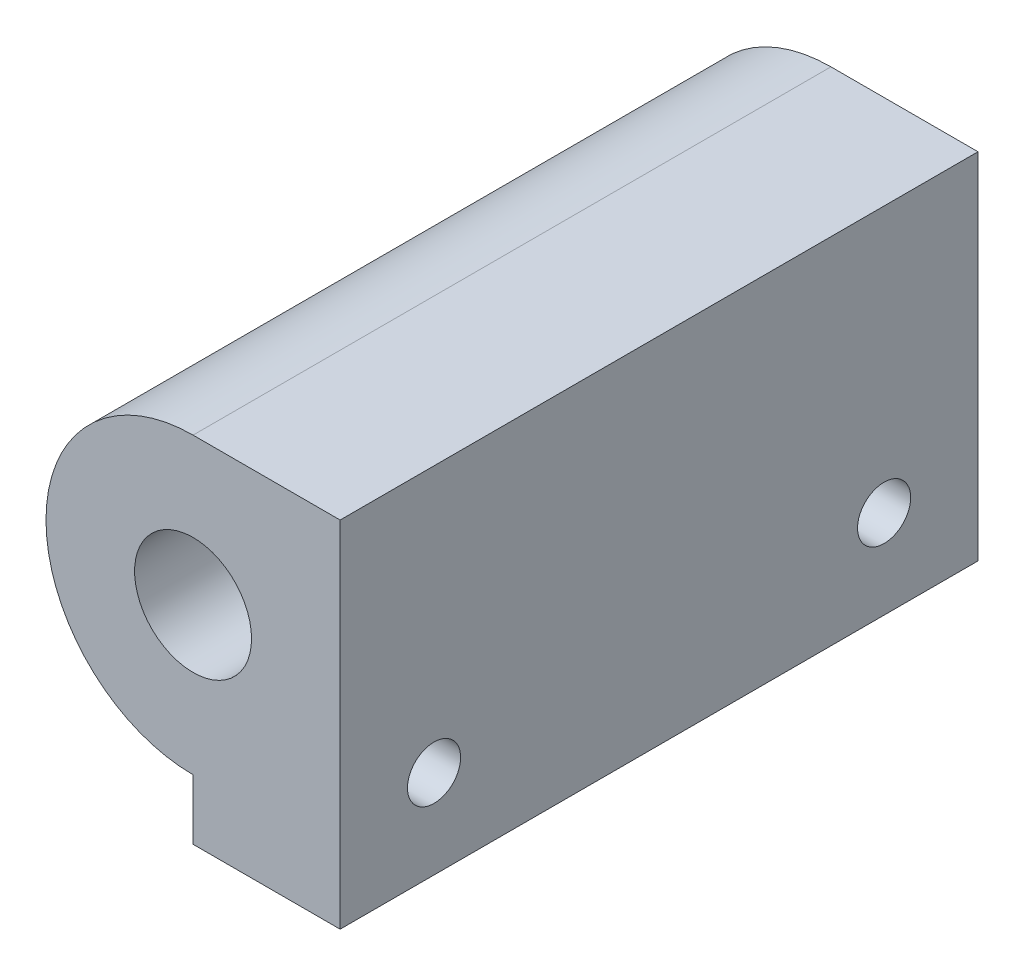
from build123d import *

# Parameters (mm, degrees)
ESQUISSE1_R             = 1.65
BOSS_EXTRU_1_DEPTH      = 9
ESQUISSE2_R             = 0.75
ENL_V_MAT_EXTRU_1_DEPTH = 14.568806138


with BuildPart() as part:
    # Esquisse1 → Boss.-Extru.1 (new, symmetric)
    with BuildSketch(Plane.XY):
        with BuildLine():
            Line((0, -4.15), (0, -5.85))
            Line((0, -5.85), (4.15, -5.85))
            Line((4.15, -5.85), (4.15, 4.15))
            Line((4.15, 4.15), (0, 4.15))
            ThreePointArc((0, 4.15), (-4.15, 0), (0, -4.15))
        make_face()
        Circle(ESQUISSE1_R, mode=Mode.SUBTRACT)
    extrude(amount=BOSS_EXTRU_1_DEPTH, both=True)

    # Esquisse2 → Enlèv. mat.-Extru.1 (cut, through all)
    with BuildSketch(Plane(origin=(4.15, 0, 0), x_dir=(0, 0, -1), z_dir=(1, 0, 0))):
        with Locations((-6.35, -3.35)):
            Circle(ESQUISSE2_R)
        with Locations((6.35, -3.35)):
            Circle(ESQUISSE2_R)
    extrude(amount=-ENL_V_MAT_EXTRU_1_DEPTH, mode=Mode.SUBTRACT)


solid = part.part
